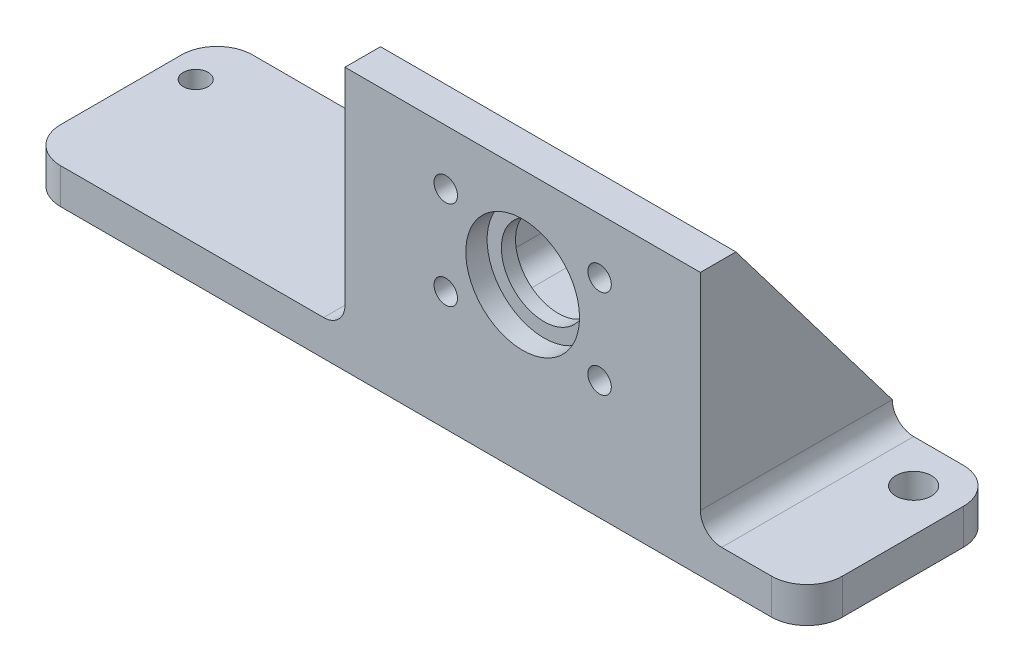
from build123d import *

# Parameters (mm, degrees)
EXTRUDE_1_DEPTH              = 5
SKETCH_3_R                   = 2.5
SKETCH_3_R_2                 = 1.75
CUT_EXTRUDE_2_DEPTH          = 78.129760793
EXTRUDE_2_DEPTH              = 32
SKETCH_11_R                  = 1.65
CUT_EXTRUDE_3_DEPTH          = 84.654049513
HOLE_WIZARD_M5_1_D           = 12
HOLE_WIZARD_M5_1_CBORE_D     = 16
HOLE_WIZARD_M5_1_CBORE_DEPTH = 3
FILLET_2_R                   = 3
CUT_EXTRUDE_4_DEPTH          = 82.351090958


with BuildPart() as part:
    # 草图2 → 凸台-拉伸1 (new body)
    with BuildSketch(Plane(origin=(0, 0, 0), x_dir=(1, 0, 0), z_dir=(0, 1, 0))):
        with BuildLine():
            Line((-70, 27), (-70, 10))
            ThreePointArc((-70, 10), (-68.535533906, 6.464466094), (-65, 5))
            Line((-65, 5), (35, 5))
            ThreePointArc((35, 5), (38.535533906, 6.464466094), (40, 10))
            Line((40, 10), (40, 27))
            ThreePointArc((40, 27), (38.535533906, 30.535533906), (35, 32))
            Line((35, 32), (-65, 32))
            ThreePointArc((-65, 32), (-68.535533906, 30.535533906), (-70, 27))
        make_face()
    extrude(amount=EXTRUDE_1_DEPTH)

    # 草图3 → 切除-拉伸2 (cut, through all)
    with BuildSketch(Plane(origin=(0, 5, 0), x_dir=(1, 0, 0), z_dir=(0, 1, 0))):
        with Locations(Location((-34, 26, 0), (0, 0, 270))):
            Circle(SKETCH_3_R)
        with Locations(Location((34, 26, 0), (0, 0, 270))):
            Circle(SKETCH_3_R)
        with Locations(Location((-66, 25, 0), (0, 0, 270))):
            Circle(SKETCH_3_R_2)
    extrude(amount=-CUT_EXTRUDE_2_DEPTH, mode=Mode.SUBTRACT)

    # 草图6 → 凸台-拉伸2 (add)
    with BuildSketch(Plane(origin=(0, 5, 0), x_dir=(1, 0, 0), z_dir=(0, 1, 0))):
        Polygon((-25, 5), (-25, 32), (-19.986167978, 32), (-19.986167978, 10), (19.383137048, 10), (19.383137048, 32), (25, 32), (25, 5), align=None)
    extrude(amount=EXTRUDE_2_DEPTH)

    # 草图11 → 切除-拉伸3 (cut, through all)
    with BuildSketch(Plane.XY.offset(-5)):
        with Locations((-10.82, 29.25)):
            Circle(SKETCH_11_R)
        with Locations((10.82, 29.25)):
            Circle(SKETCH_11_R)
        with Locations((-10.82, 16.75)):
            Circle(SKETCH_11_R)
        with Locations((10.82, 16.75)):
            Circle(SKETCH_11_R)
    extrude(amount=-CUT_EXTRUDE_3_DEPTH, mode=Mode.SUBTRACT)

    # M5 六角头螺钉的柱形沉头孔1 (through all)
    with Locations(Plane(origin=(-0.000886088, 23, -5), x_dir=(1, 0, 0), z_dir=(0, 0, 1))):
        with Locations((0, 0)):
            CounterBoreHole(HOLE_WIZARD_M5_1_D / 2, HOLE_WIZARD_M5_1_CBORE_D / 2, HOLE_WIZARD_M5_1_CBORE_DEPTH)

    # 圆角2
    fillet_2_edges = [part.edges().sort_by_distance(p)[0] for p in [
        (-25, 5, -18.5),
        (19.383137048, 21, -10),
        (-19.986167978, 21, -10),
        (-19.986167978, 5, -21),
        (19.383137048, 5, -21),
        (25, 5, -18.5),
        (-0.301515465, 5, -10),
    ]]
    fillet(fillet_2_edges, radius=FILLET_2_R)

    # 草图18 → 切除-拉伸4 (cut, through all)
    with BuildSketch(Plane.ZY.offset(25)):
        Polygon((-10, 37), (-32, 8), (-32, 37), align=None)
    extrude(amount=-CUT_EXTRUDE_4_DEPTH, mode=Mode.SUBTRACT)


solid = part.part
